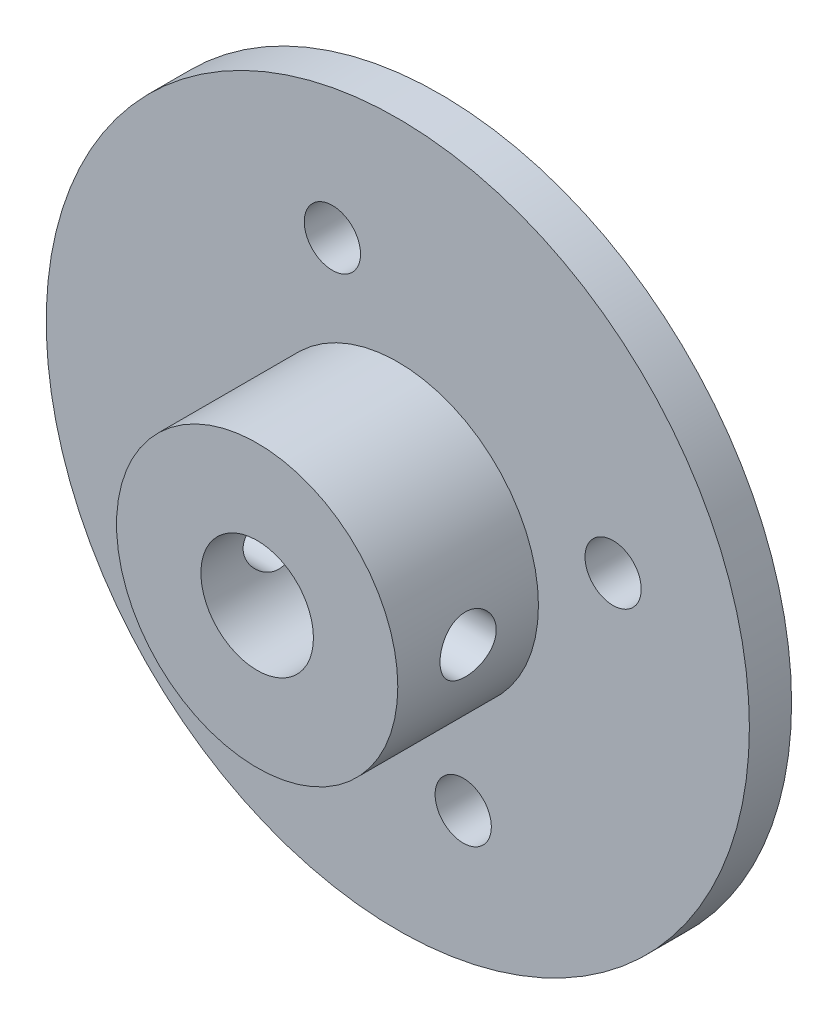
from build123d import *

# Parameters (mm, degrees)
CROQUIS1_R                 = 25
SALIENTE_EXTRUIR1_DEPTH    = 3
CROQUIS2_R                 = 10
SALIENTE_EXTRUIR2_DEPTH    = 10
CROQUIS3_R                 = 4
CORTAR_EXTRUIR1_DEPTH      = 38.669616404
CROQUIS4_R                 = 2
CORTAR_EXTRUIR2_DEPTH      = 37.742346142
CORTAR_EXTRUIR3_DEPTH      = 38.669616404
CORTAR_EXTRUIR3_DEPTH_BACK = 38.669616404
CROQUIS5_R                 = 2


with BuildPart() as part:
    # Croquis1 → Saliente-Extruir1 (new body)
    with BuildSketch(Plane.XY):
        Circle(CROQUIS1_R)
    extrude(amount=SALIENTE_EXTRUIR1_DEPTH)

    # Croquis2 → Saliente-Extruir2 (add)
    with BuildSketch(Plane.XY.offset(3)):
        Circle(CROQUIS2_R)
    extrude(amount=SALIENTE_EXTRUIR2_DEPTH)

    # Croquis3 → Cortar-Extruir1 (cut, through all)
    with BuildSketch(Plane.XY.offset(13)):
        Circle(CROQUIS3_R)
    extrude(amount=-CORTAR_EXTRUIR1_DEPTH, mode=Mode.SUBTRACT)

    # Croquis4 → Cortar-Extruir2 (cut, through all)
    with BuildSketch(Plane.XY.offset(3)):
        with Locations((-4.65167861, 15.308882589)):
            Circle(CROQUIS4_R)
        with Locations((15.308882589, 4.65167861)):
            Circle(CROQUIS4_R)
        with Locations((4.65167861, -15.308882589)):
            Circle(CROQUIS4_R)
        with Locations((-15.308882589, -4.65167861)):
            Circle(CROQUIS4_R)
    extrude(amount=-CORTAR_EXTRUIR2_DEPTH, mode=Mode.SUBTRACT)

    # Croquis5 → Cortar-Extruir3 (cut, two sides: drawn at the far end of the back side and taken through both)
    with BuildSketch(Plane(origin=(0, 0, 0), x_dir=(0, 0, -1), z_dir=(1, 0, 0)).offset(-CORTAR_EXTRUIR3_DEPTH_BACK)):
        with Locations((-8, 0)):
            Circle(CROQUIS5_R)
    extrude(amount=CORTAR_EXTRUIR3_DEPTH + CORTAR_EXTRUIR3_DEPTH_BACK, mode=Mode.SUBTRACT)


solid = part.part
